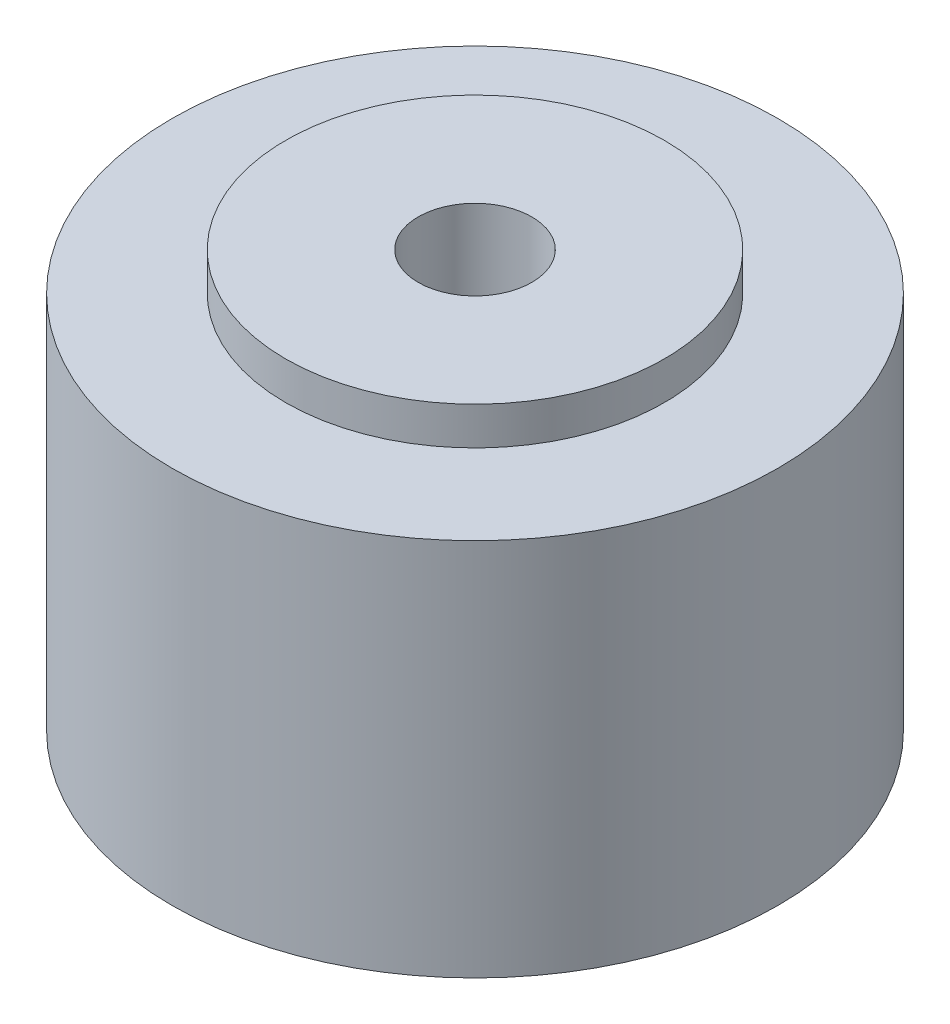
from build123d import *

# Parameters (mm, degrees)
SKETCH_1_R      = 2.5
SKETCH_1_R_2    = 0.75
EXTRUDE_1_DEPTH = 3
SKETCH_2_R      = 4
SKETCH_2_R_2    = 2.5
EXTRUDE_2_DEPTH = 2.5


with BuildPart() as part:
    # 草图1 → 凸台-拉伸1 (new, symmetric)
    with BuildSketch(Plane(origin=(0, 0, 0), x_dir=(1, 0, 0), z_dir=(0, 1, 0))):
        with Locations(Location((0, 0, 0), (0, 0, 270))):
            Circle(SKETCH_1_R)
        with Locations(Location((0, 0, 0), (0, 0, 270))):
            Circle(SKETCH_1_R_2, mode=Mode.SUBTRACT)
    extrude(amount=EXTRUDE_1_DEPTH, both=True)

    # 草图2 → 凸台-拉伸2 (add, symmetric)
    with BuildSketch(Plane(origin=(0, 0, 0), x_dir=(1, 0, 0), z_dir=(0, 1, 0))):
        with Locations(Location((0, 0, 0), (0, 0, 270))):
            Circle(SKETCH_2_R)
        with Locations(Location((0, 0, 0), (0, 0, 270))):
            Circle(SKETCH_2_R_2, mode=Mode.SUBTRACT)
    extrude(amount=EXTRUDE_2_DEPTH, both=True)


solid = part.part
